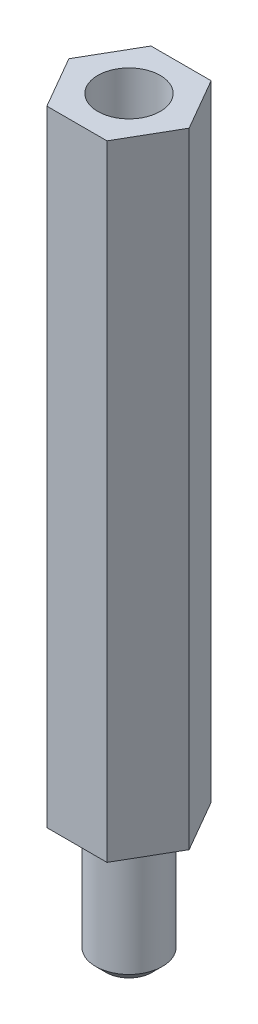
from build123d import *

# Parameters (mm, degrees)
SKETCH1_R           = 1.5
EXTRUDE1_DEPTH      = 30
EXTRUDE2_DEPTH      = 6
EXTRUDE2_DEPTH_BACK = 22
SKETCH2_R           = 1.6
CHAMFER1_SIZE       = 0.5
FILLET1_R           = 0.5
FILLET2_R           = 1


with BuildPart() as part:
    # Sketch1 → Extrude1 (new body)
    with BuildSketch(Plane(origin=(0, 0, 0), x_dir=(1, 0, 0), z_dir=(0, 1, 0))):
        Polygon((-1.443375673, 2.5), (1.443375673, 2.5), (2.886751346, 0), (1.443375673, -2.5), (-1.443375673, -2.5), (-2.886751346, 0), align=None)
        with Locations(Location((0, 0, 0), (0, 0, 270))):
            Circle(SKETCH1_R, mode=Mode.SUBTRACT)
    extrude(amount=EXTRUDE1_DEPTH)

    # Sketch2 → Extrude2 (add, two sides: drawn at the far end of the back side and taken through both)
    with BuildSketch(Plane.XZ.offset(-EXTRUDE2_DEPTH_BACK)):
        with Locations(Location((0, 0, 0), (0, 0, 270))):
            Circle(SKETCH2_R)
    extrude(amount=EXTRUDE2_DEPTH + EXTRUDE2_DEPTH_BACK)

    # Chamfer1
    chamfer1_edges = [part.edges().sort_by_distance(p)[0] for p in [
        (0, -6, 1.6),
    ]]
    chamfer(chamfer1_edges, length=CHAMFER1_SIZE)

    # Fillet1
    fillet1_edges = [part.edges().sort_by_distance(p)[0] for p in [
        (0, 0, 1.6),
    ]]
    fillet(fillet1_edges, radius=FILLET1_R)

    # Fillet2
    fillet2_edges = [part.edges().sort_by_distance(p)[0] for p in [
        (0, 22, -1.5),
    ]]
    fillet(fillet2_edges, radius=FILLET2_R)


solid = part.part
